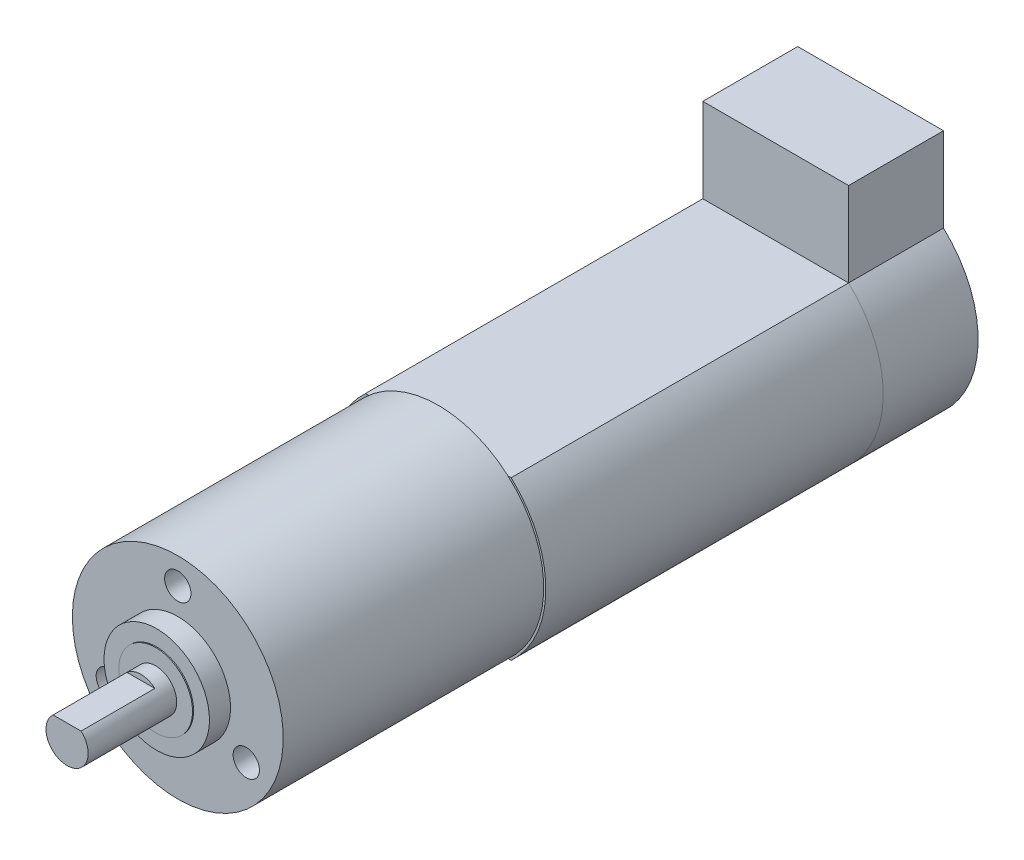
from build123d import *

# Parameters (mm, degrees)
BOSS_EXTRUDE1_DEPTH = 7
SKETCH2_R           = 2
BOSS_EXTRUDE2_DEPTH = 1.4
SKETCH3_R           = 3.5
BOSS_EXTRUDE3_DEPTH = 0.1
SKETCH4_R           = 5
BOSS_EXTRUDE4_DEPTH = 2
SKETCH5_R           = 10
BOSS_EXTRUDE5_DEPTH = 24.7
SKETCH6_R           = 1.25
SCREW_HOLES_DEPTH   = 5
MOTOR_DEPTH         = 32
ENCODER_DEPTH       = 9


with BuildPart() as part:
    # Sketch1 → Boss-Extrude1 (new body)
    with BuildSketch(Plane.XY):
        with BuildLine():
            Line((-1.322875656, 1.5), (1.322875656, 1.5))
            ThreePointArc((1.322875656, 1.5), (0, -2), (-1.322875656, 1.5))
        make_face()
    extrude(amount=-BOSS_EXTRUDE1_DEPTH)

    # Sketch2 → Boss-Extrude2 (add)
    with BuildSketch(Plane(origin=(0, 0, -7), x_dir=(-1, 0, 0), z_dir=(0, 0, -1))):
        with Locations(Location((0, 0, 0), (0, 0, 131.409622109))):
            Circle(SKETCH2_R)
    extrude(amount=BOSS_EXTRUDE2_DEPTH)

    # Sketch3 → Boss-Extrude3 (add)
    with BuildSketch(Plane(origin=(0, 0, -8.4), x_dir=(-1, 0, 0), z_dir=(0, 0, -1))):
        Circle(SKETCH3_R)
    extrude(amount=BOSS_EXTRUDE3_DEPTH)


with BuildPart() as body_2:
    # Sketch4 → Boss-Extrude4 (new body)
    with BuildSketch(Plane(origin=(0, 0, -8.5), x_dir=(-1, 0, 0), z_dir=(0, 0, -1))):
        Circle(SKETCH4_R)
    extrude(amount=BOSS_EXTRUDE4_DEPTH)

    # Sketch5 → Boss-Extrude5 (add)
    with BuildSketch(Plane(origin=(0, 0, -10.5), x_dir=(-1, 0, 0), z_dir=(0, 0, -1))):
        Circle(SKETCH5_R)
    extrude(amount=BOSS_EXTRUDE5_DEPTH)

    # Sketch6 → Screw Holes (cut)
    with BuildSketch(Plane.XY.offset(-10.5)):
        with Locations((0, 7.5)):
            Circle(SKETCH6_R)
        with Locations((6.495190528, -3.75)):
            Circle(SKETCH6_R)
        with Locations((-6.495190528, -3.75)):
            Circle(SKETCH6_R)
    extrude(amount=-SCREW_HOLES_DEPTH, mode=Mode.SUBTRACT)


with BuildPart() as body_3:
    # Sketch10 → Motor (new body)
    with BuildSketch(Plane(origin=(0, 0, -35.2), x_dir=(-1, 0, 0), z_dir=(0, 0, -1))):
        with BuildLine():
            Line((-6.913031173, 7.5), (6.913031173, 7.5))
            ThreePointArc((6.913031173, 7.5), (10.2, 0), (6.913031173, -7.5))
            Line((6.913031173, -7.5), (-6.913031173, -7.5))
            ThreePointArc((-6.913031173, -7.5), (-10.2, 0), (-6.913031173, 7.5))
        make_face()
    extrude(amount=MOTOR_DEPTH)


with BuildPart() as body_4:
    # Sketch11 → Encoder (new body)
    with BuildSketch(Plane(origin=(0, 0, -67.2), x_dir=(-1, 0, 0), z_dir=(0, 0, -1))):
        with BuildLine():
            Line((-6.913031173, -7.5), (6.913031173, -7.5))
            ThreePointArc((6.913031173, -7.5), (10.2, 0), (6.913031173, 7.5))
            Line((6.913031173, 7.5), (6.913031173, 15.5))
            Line((6.913031173, 15.5), (-6.913031173, 15.5))
            Line((-6.913031173, 15.5), (-6.913031173, 7.5))
            ThreePointArc((-6.913031173, 7.5), (-10.2, 0), (-6.913031173, -7.5))
        make_face()
    extrude(amount=ENCODER_DEPTH)


solid = Compound([part.part, body_2.part, body_3.part, body_4.part])
